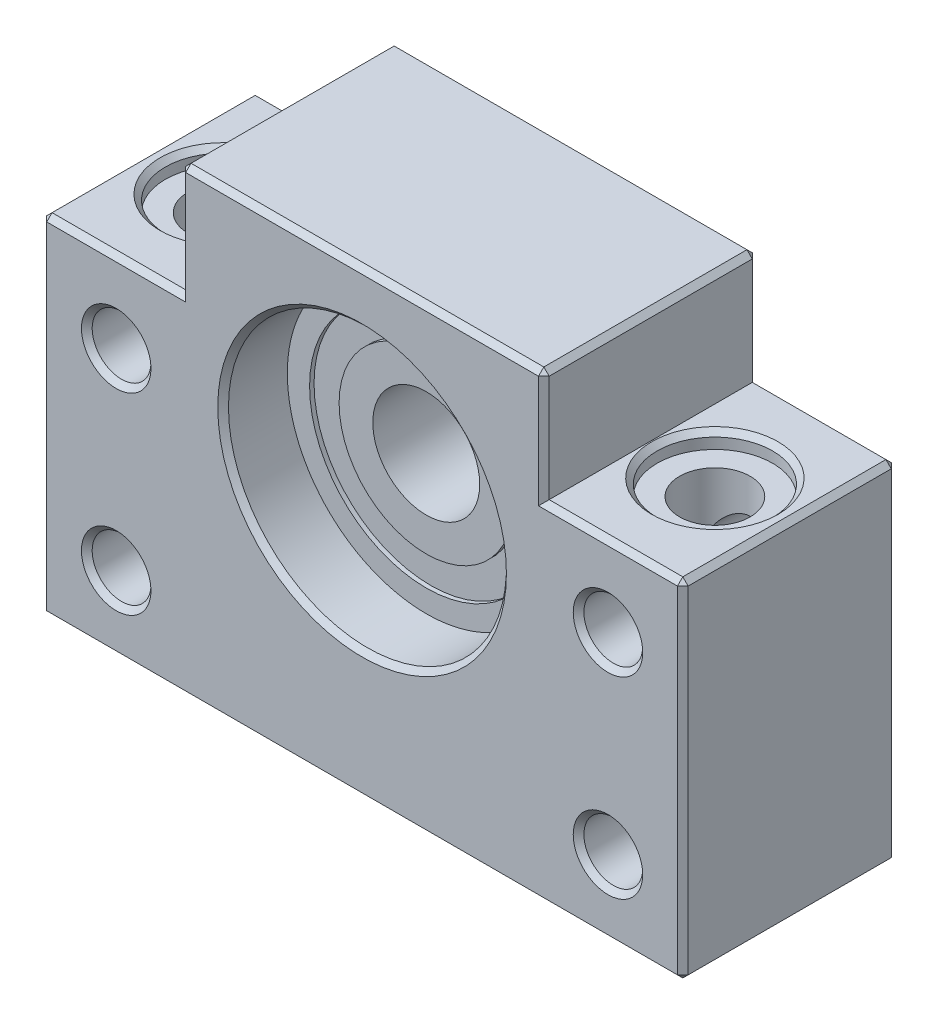
from build123d import *

# Parameters (mm, degrees)
SKETCH1_R           = 13
BOSS_EXTRUDE1_DEPTH = 10
SKETCH2_R           = 2.75
CUT_EXTRUDE1_DEPTH  = 44.874821937
SKETCH3_R           = 3.3
CUT_EXTRUDE2_DEPTH  = 46.345892868
SKETCH4_R           = 5.4
CUT_EXTRUDE3_DEPTH  = 1.5
CHAMFER1_SIZE       = 0.5


with BuildPart() as part:
    # Sketch1 → Boss-Extrude1 (new, symmetric)
    with BuildSketch(Plane.XY):
        Polygon((17, 18), (-17, 18), (-17, 7.5), (-30, 7.5), (-30, -25), (30, -25), (30, 7.5), (17, 7.5), align=None)
        Circle(SKETCH1_R, mode=Mode.SUBTRACT)
    extrude(amount=BOSS_EXTRUDE1_DEPTH, both=True)

    # Sketch2 → Cut-Extrude1 (cut, through all)
    with BuildSketch(Plane.XY.offset(10)):
        with Locations((-23, 0)):
            Circle(SKETCH2_R)
        with Locations((-23, -18)):
            Circle(SKETCH2_R)
        with Locations(Location((23, -18, 0), (0, 0, 180))):
            Circle(SKETCH2_R)
        with Locations(Location((23, 0, 0), (0, 0, 180))):
            Circle(SKETCH2_R)
    extrude(amount=-CUT_EXTRUDE1_DEPTH, mode=Mode.SUBTRACT)

    # Sketch3 → Cut-Extrude2 (cut, through all)
    with BuildSketch(Plane(origin=(0, 7.5, 0), x_dir=(1, 0, 0), z_dir=(0, 1, 0))):
        with Locations(Location((-23, 0, 0), (0, 0, 180))):
            Circle(SKETCH3_R)
        with Locations((23, 0)):
            Circle(SKETCH3_R)
    extrude(amount=-CUT_EXTRUDE2_DEPTH, mode=Mode.SUBTRACT)

    # Sketch4 → Cut-Extrude3 (cut)
    with BuildSketch(Plane(origin=(0, 7.5, 0), x_dir=(1, 0, 0), z_dir=(0, 1, 0))):
        with Locations(Location((-23, 0, 0), (0, 0, 180))):
            Circle(SKETCH4_R)
        with Locations(Location((23, 0, 0), (0, 0, 180))):
            Circle(SKETCH4_R)
    extrude(amount=-CUT_EXTRUDE3_DEPTH, mode=Mode.SUBTRACT)

    # Chamfer1
    chamfer1_edges = [part.edges().sort_by_distance(p)[0] for p in [
        (-30, -8.75, 10),
        (-23.5, 7.5, -10),
        (-17, 12.75, -10),
        (0, -25, 10),
        (-17, 18, 0),
        (17, 18, 0),
        (30, 7.5, 0),
        (30, -25, 0),
        (-30, -25, 0),
        (-30, 7.5, 0),
        (30, -8.75, 10),
        (23.5, 7.5, 10),
        (-13, 0, -10),
        (-13, 0, 10),
        (17, 12.75, 10),
        (0, 18, 10),
        (-25.75, 0, -10),
        (-25.75, 0, 10),
        (-25.75, -18, -10),
        (-25.75, -18, 10),
        (25.75, -18, -10),
        (25.75, -18, 10),
        (25.75, 0, -10),
        (25.75, 0, 10),
        (-17, 12.75, 10),
        (-17.6, 7.5, 0),
        (-23.5, 7.5, 10),
        (28.4, 7.5, 0),
        (0, 18, -10),
        (17, 12.75, -10),
        (23.5, 7.5, -10),
        (30, -8.75, -10),
        (0, -25, -10),
        (-30, -8.75, -10),
    ]]
    chamfer(chamfer1_edges, length=CHAMFER1_SIZE)


with BuildPart() as body_2:
    # Sketch5 → Revolve1 (revolve)
    with BuildSketch(Plane(origin=(0, 0, 0), x_dir=(1, 0, 0), z_dir=(0, 1, 0)), mode=Mode.PRIVATE) as revolve1_sk:
        Polygon((-13, 4), (-10.911412894, 4), (-10.911412894, 3.582423173), (-8.151084393, 3.582423173), (-8.151084393, 4), (-5, 4), (-5, 0), (-13, 0), align=None)
    revolve(revolve1_sk.sketch.rotate(Axis((0, 0, 0), (0, 0, -1)), 180), axis=Axis((0, 0, 0), (0, 0, -1)))

    # Mirror2: body 2 across plane


with BuildPart() as body_2_1:
    add(body_2.part)
    add(body_2.part.mirror(Plane(origin=(-13, 0, 0), x_dir=(1, 0, 0), z_dir=(0, 0, -1))))


solid = Compound([part.part, body_2_1.part])
